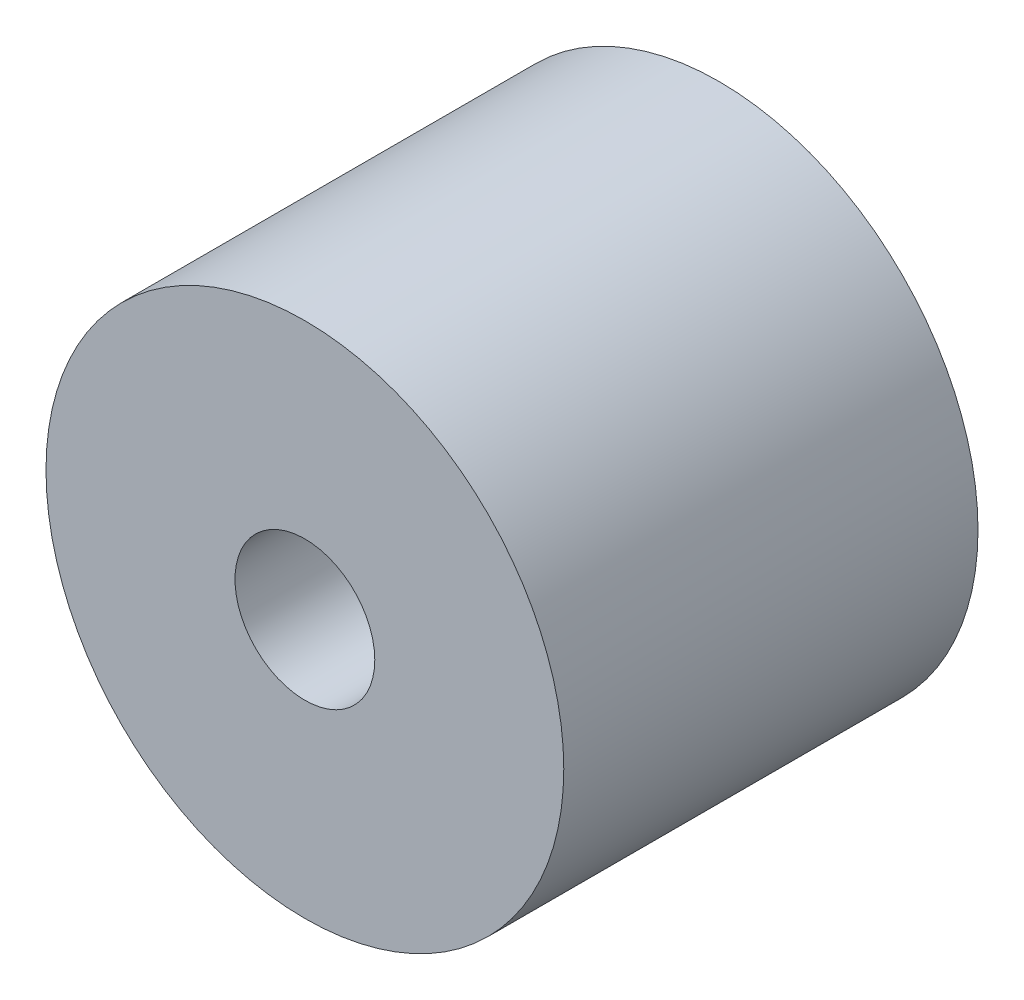
from build123d import *

# Parameters (mm, degrees)
SKETCH1_R                    = 6.35
BOSS_EXTRUDE1_DEPTH          = 10.16
F_3_8_0_135_DIAMETER_HOLE1_D = 3.429


with BuildPart() as part:
    # Sketch1 → Boss-Extrude1 (new body)
    with BuildSketch(Plane.XY):
        Circle(SKETCH1_R)
    extrude(amount=BOSS_EXTRUDE1_DEPTH)

    # 3/8 (0.135) Diameter Hole1 (through all)
    with Locations(Plane.XY.offset(10.16)):
        with Locations((0, 0)):
            Hole(F_3_8_0_135_DIAMETER_HOLE1_D / 2)


solid = part.part
